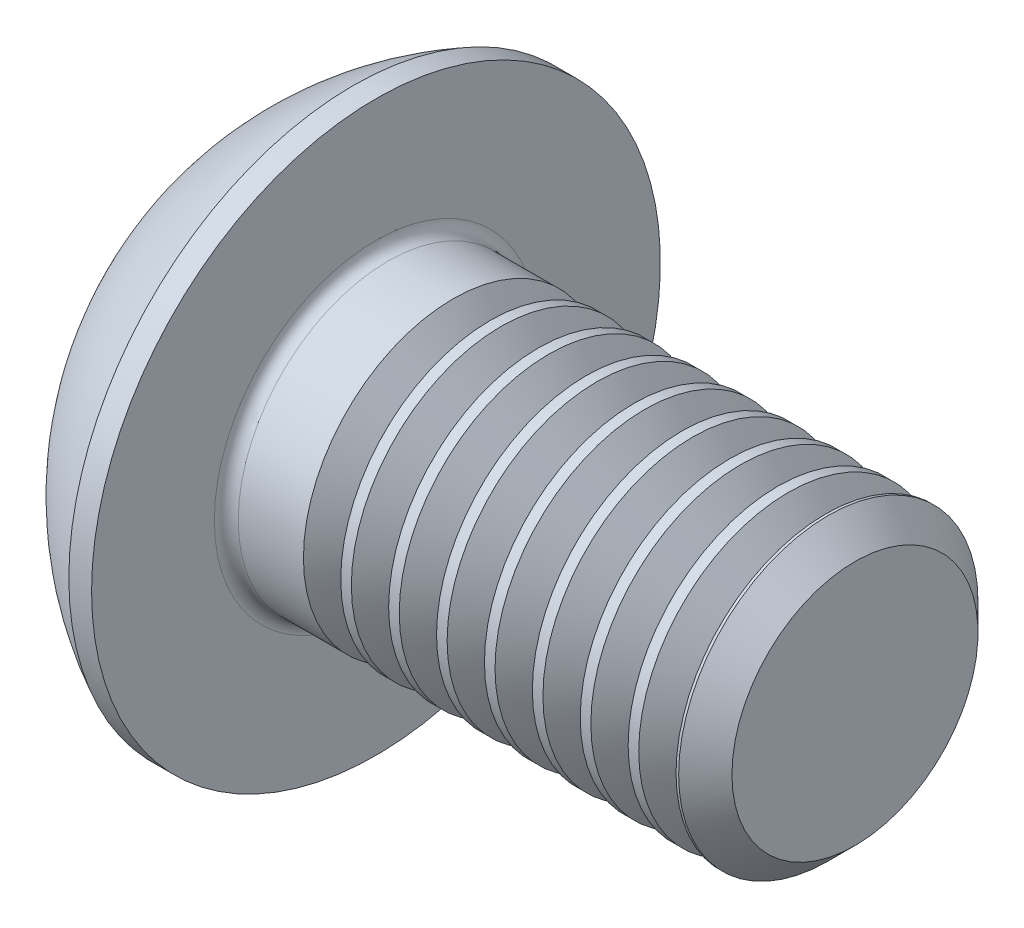
from build123d import *

# Parameters (mm, degrees)
FILLET1_R       = 0.2
HEX_2_DEPTH     = 1.56
THDSCHPAT_COUNT = 8
THDSCHPAT_PITCH = 0.8


with BuildPart() as part:
    # BodySke → BaseBody (revolve)
    with BuildSketch(Plane.XY, mode=Mode.PRIVATE) as basebody_sk:
        with BuildLine():
            Line((10.75, 0), (10.75, 2.055))
            Line((10.75, 2.055), (10.305, 2.5))
            Line((10.305, 2.5), (2.75, 2.5))
            Line((2.75, 2.5), (2.75, 4.75))
            Line((2.75, 4.75), (2.37, 4.75))
            ThreePointArc((2.37, 4.75), (0.992680215, 3.754414901), (0, 2.375))
            Line((0, 2.375), (0, 0))
            Line((0, 0), (10.75, 0))
        make_face()
    revolve(basebody_sk.sketch.rotate(Axis((0, 0, 0), (1, 0, 0)), 90), axis=Axis((0, 0, 0), (1, 0, 0)))

    # Fillet1
    fillet1_edges = [part.edges().sort_by_distance(p)[0] for p in [
        (2.75, 0, -2.5),
    ]]
    fillet(fillet1_edges, radius=FILLET1_R)

    # Sketch2 → PreBroach (revolve, cut)
    with BuildSketch(Plane.XY, mode=Mode.PRIVATE) as prebroach_sk:
        Polygon((0, 1.5), (1.56, 1.5), (2.426025404, 0), (0, 0), align=None)
    revolve(prebroach_sk.sketch.rotate(Axis((0, 0, 0), (1, 0, 0)), 90), axis=Axis((0, 0, 0), (1, 0, 0)), mode=Mode.SUBTRACT)

    # Sketch3 → Hex 2 (cut)
    with BuildSketch(Plane(origin=(0, 0, 0), x_dir=(0, 0, -1), z_dir=(1, 0, 0))):
        Polygon((-1.5, -0.866025404), (-1.5, 0.866025404), (0, 1.732050808), (1.5, 0.866025404), (1.5, -0.866025404), (0, -1.732050808), align=None)
    extrude(amount=HEX_2_DEPTH, mode=Mode.SUBTRACT)

    # ThdSchSke → ThreadSchematic (revolve, cut)
    with BuildSketch(Plane.XY, mode=Mode.PRIVATE) as threadschematic_sk:
        Polygon((4.35, -2.055), (4.038407645, -2.5), (4.038407645, -3.125), (4.661592355, -3.125), (4.661592355, -2.5), align=None)
    threadschematic = revolve(threadschematic_sk.sketch.rotate(Axis((-3.175, 0, 0), (1, 0, 0)), 270), axis=Axis((-3.175, 0, 0), (1, 0, 0)), mode=Mode.SUBTRACT)

    # ThdSchPat: ThreadSchematic ×8
    with Locations(*[(i * THDSCHPAT_PITCH, 0, 0) for i in range(1, THDSCHPAT_COUNT)]):
        add(threadschematic, mode=Mode.SUBTRACT)


solid = part.part
